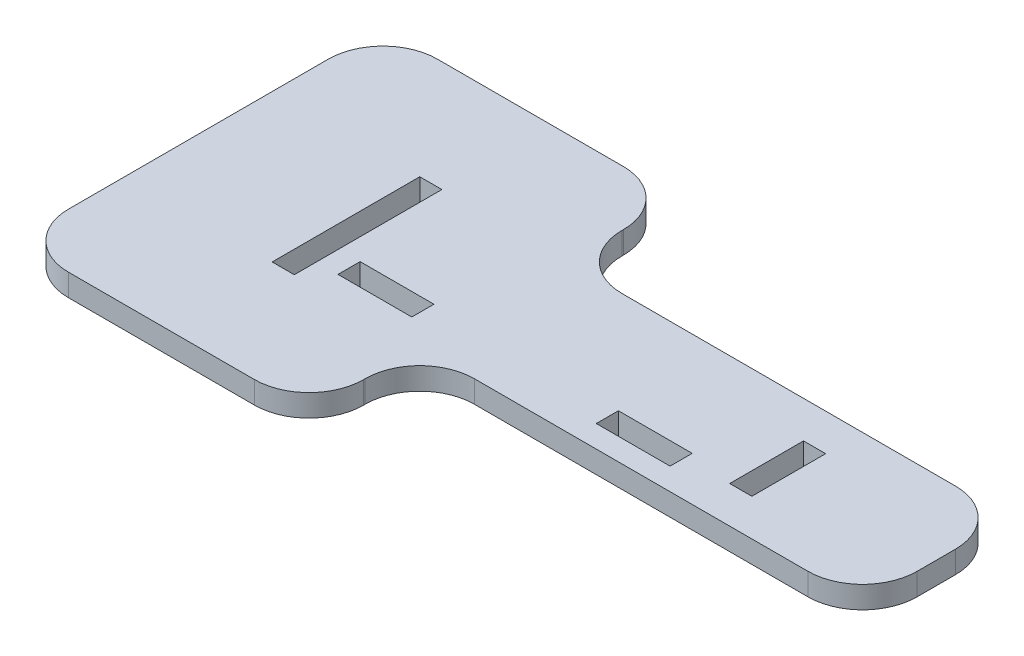
from build123d import *

# Parameters (mm, degrees)
SKETCH1_W           = 100
SKETCH1_H           = 50
BOSS_EXTRUDE1_DEPTH = 3
SKETCH2_W           = 60
SKETCH2_H           = 15
CUT_EXTRUDE1_DEPTH  = 3
FILLET1_R           = 7.4
SKETCH3_W           = 3
SKETCH3_H           = 20
SKETCH3_H_2         = 10
CUT_EXTRUDE2_DEPTH  = 10
SKETCH4_W           = 10
SKETCH4_H           = 3
CUT_EXTRUDE3_DEPTH  = 3


with BuildPart() as part:
    # Sketch1 → Boss-Extrude1 (new body)
    with BuildSketch(Plane(origin=(0, 0, 0), x_dir=(1, 0, 0), z_dir=(0, 1, 0))):
        with Locations((50, 25)):
            Rectangle(SKETCH1_W, SKETCH1_H)
    extrude(amount=BOSS_EXTRUDE1_DEPTH)

    # Sketch2 → Cut-Extrude1 (cut)
    with BuildSketch(Plane(origin=(0, 3, 0), x_dir=(1, 0, 0), z_dir=(0, 1, 0))):
        with Locations((70, 7.5)):
            Rectangle(SKETCH2_W, SKETCH2_H)
        with Locations((70, 42.5)):
            Rectangle(SKETCH2_W, SKETCH2_H)
    extrude(amount=-CUT_EXTRUDE1_DEPTH, mode=Mode.SUBTRACT)

    # Fillet1
    fillet1_edges = [part.edges().sort_by_distance(p)[0] for p in [
        (100, 1.5, -15),
        (40, 1.5, 0),
        (40, 1.5, -15),
        (100, 1.5, -35),
        (40, 1.5, -35),
        (40, 1.5, -50),
        (0, 1.5, -50),
        (0, 1.5, 0),
    ]]
    fillet(fillet1_edges, radius=FILLET1_R)

    # Sketch3 → Cut-Extrude2 (cut)
    with BuildSketch(Plane.XZ):
        with Locations((21.5, -25)):
            Rectangle(SKETCH3_W, SKETCH3_H)
        with Locations((78.5, -25)):
            Rectangle(SKETCH3_W, SKETCH3_H_2)
    extrude(amount=-CUT_EXTRUDE2_DEPTH, mode=Mode.SUBTRACT)

    # Sketch4 → Cut-Extrude3 (cut)
    with BuildSketch(Plane.XZ):
        with Locations((30.91970706, -19.5)):
            Rectangle(SKETCH4_W, SKETCH4_H)
        with Locations((65.91970706, -19.5)):
            Rectangle(SKETCH4_W, SKETCH4_H)
    extrude(amount=-CUT_EXTRUDE3_DEPTH, mode=Mode.SUBTRACT)


solid = part.part
